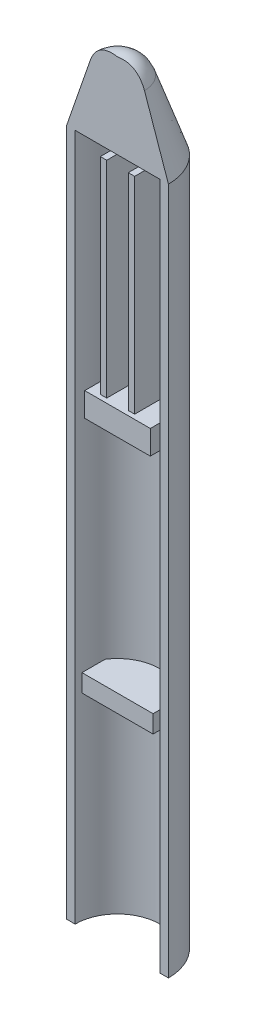
from build123d import *

# Parameters (mm, degrees)
SKETCH2_W           = 2
SKETCH2_H           = 162.039928857
BOSS_EXTRUDE1_REACH = 94.669
SKETCH4_W           = 15.457813272
SKETCH4_H           = 5.65259454
SKETCH4_W_2         = 16.763190872
SKETCH4_H_2         = 4.156828513
SKETCH4_W_3         = 1.5
SKETCH4_H_3         = 48.554461885
BOSS_EXTRUDE2_REACH = 104.169
BOSS_EXTRUDE2_START = -9.5
SKETCH4_4_W         = 5.08
SKETCH4_4_H         = 48.554461885
SKETCH5_W           = 72.783621468
SKETCH5_H           = 192.84631039
CUT_EXTRUDE1_DEPTH  = 93.66850023


with BuildPart() as part:
    # Sketch1 → Revolve1 (revolve)
    with BuildSketch(Plane.XY):
        with BuildLine():
            Line((6.354000149, 87.279039692), (12, 71))
            Line((12, 71), (0, 71))
            Line((0, 71), (0, 91))
            add(Edge.make_bspline(
                [(0, 91), (4.668589185, 91.723642341), (6.354000149, 87.279039692)],
                knots=[0, 0, 0, 1, 1, 1], degree=2))
        make_face()
    revolve(axis=Axis((0, 91, 0), (0, -1, 0)))

    # Sketch2 → Revolve2 (revolve)
    with BuildSketch(Plane.XY):
        with Locations((11, -10.019964429)):
            Rectangle(SKETCH2_W, SKETCH2_H)
    revolve(axis=Axis((0, 91, 0), (0, -1, 0)))

    # Sketch4 → Boss-Extrude1 (add, up to next)
    with BuildSketch(Plane.XY, mode=Mode.PRIVATE) as boss_extrude1_sk1:
        with Locations((0, 16.17370273)):
            Rectangle(SKETCH4_W, SKETCH4_H)
    boss_extrude1_tool1 = extrude(boss_extrude1_sk1.sketch, amount=-BOSS_EXTRUDE1_REACH, mode=Mode.PRIVATE) - part.part
    # Sketch4 → Boss-Extrude1 (add, up to next)
    with BuildSketch(Plane.XY, mode=Mode.PRIVATE) as boss_extrude1_sk2:
        with Locations((0, -40.974423961)):
            Rectangle(SKETCH4_W_2, SKETCH4_H_2)
    boss_extrude1_tool2 = extrude(boss_extrude1_sk2.sketch, amount=-BOSS_EXTRUDE1_REACH, mode=Mode.PRIVATE) - part.part
    # Sketch4 → Boss-Extrude1 (add, up to next)
    with BuildSketch(Plane.XY, mode=Mode.PRIVATE) as boss_extrude1_sk3:
        with Locations((3.29, 44.344804049)):
            Rectangle(SKETCH4_W_3, SKETCH4_H_3)
    boss_extrude1_tool3 = extrude(boss_extrude1_sk3.sketch, amount=-BOSS_EXTRUDE1_REACH, mode=Mode.PRIVATE) - part.part
    # Sketch4 → Boss-Extrude1 (add, up to next)
    with BuildSketch(Plane.XY, mode=Mode.PRIVATE) as boss_extrude1_sk4:
        with Locations((-3.29, 44.344804049)):
            Rectangle(SKETCH4_W_3, SKETCH4_H_3)
    boss_extrude1_tool4 = extrude(boss_extrude1_sk4.sketch, amount=-BOSS_EXTRUDE1_REACH, mode=Mode.PRIVATE) - part.part
    add(boss_extrude1_tool1.solids().sort_by_distance((0, 16.173703, 0))[0])
    add(boss_extrude1_tool2.solids().sort_by_distance((0, -40.974424, 0))[0])
    add(boss_extrude1_tool3.solids().sort_by_distance((3.29, 44.344804, 0))[0])
    add(boss_extrude1_tool4.solids().sort_by_distance((-3.29, 44.344804, 0))[0])

    # Sketch4<4> → Boss-Extrude2 (add, up to next)
    with BuildSketch(Plane.XY.offset(BOSS_EXTRUDE2_START), mode=Mode.PRIVATE) as boss_extrude2_sk1:
        with Locations((0, 44.344804049)):
            Rectangle(SKETCH4_4_W, SKETCH4_4_H)
    boss_extrude2_tool1 = extrude(boss_extrude2_sk1.sketch, amount=-BOSS_EXTRUDE2_REACH, mode=Mode.PRIVATE) - part.part
    add(boss_extrude2_tool1.solids().sort_by_distance((0, 44.344804, -9.5))[0])

    # Sketch5 → Cut-Extrude1 (cut, through all)
    with BuildSketch(Plane.XY):
        Rectangle(SKETCH5_W, SKETCH5_H)
    extrude(amount=CUT_EXTRUDE1_DEPTH, mode=Mode.SUBTRACT)


solid = part.part
